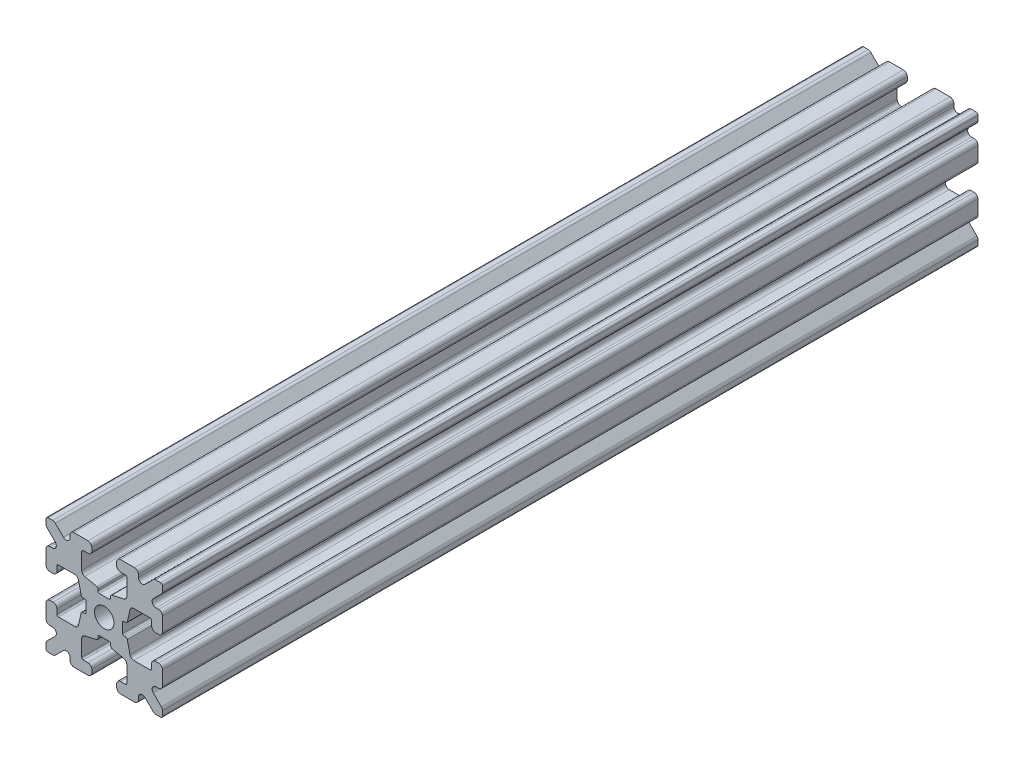
from build123d import *

# Parameters (mm, degrees)
SKETCH1_W           = 15
SKETCH1_H           = 15
SKETCH1_R           = 1.25
BOSS_EXTRUDE1_DEPTH = 52.5
FILLET1_R           = 0.25
CUT_EXTRUDE1_DEPTH  = 106.534354596
CUT_EXTRUDE3_DEPTH  = 106.534354596
FILLET3_R           = 0.5
FILLET4_R           = 0.5
FILLET5_R           = 3
FILLET6_R           = 0.2
CUT_EXTRUDE4_DEPTH  = 106.534354596
FILLET8_R           = 0.5
SKETCH6_W           = 5.1529354
SKETCH6_H           = 1.651
SKETCH6_W_2         = 1.651
SKETCH6_H_2         = 5.1529354
CUT_EXTRUDE5_DEPTH  = 106.534354596
FILLET10_R          = 0.2


with BuildPart() as part:
    # Sketch1 → Boss-Extrude1 (new, symmetric)
    with BuildSketch(Plane.XY):
        Rectangle(SKETCH1_W, SKETCH1_H)
        with Locations(Location((0, 0, 0), (0, 0, 180))):
            Circle(SKETCH1_R, mode=Mode.SUBTRACT)
    extrude(amount=BOSS_EXTRUDE1_DEPTH, both=True)

    # Fillet1
    fillet1_edges = [part.edges().sort_by_distance(p)[0] for p in [
        (7.5, -7.5, 0),
        (-7.5, -7.5, 0),
        (-7.5, 7.5, 0),
        (7.5, 7.5, 0),
    ]]
    fillet(fillet1_edges, radius=FILLET1_R)

    # Sketch2 → Cut-Extrude1 (cut, through all)
    with BuildSketch(Plane.XY.offset(52.5)):
        Polygon((-7.5, 1.6), (-6.1, 1.6), (-6.1, 2.9), (-3.4, 2.9), (-3.4, -2.9), (-6.1, -2.9), (-6.1, -1.6), (-7.5, -1.6), align=None)
        Polygon((2.9, 6.1), (1.6, 6.1), (1.6, 7.5), (-1.6, 7.5), (-1.6, 6.1), (-2.9, 6.1), (-2.9, 3.4), (2.9, 3.4), align=None)
        Polygon((-1.6, -7.5), (-1.6, -6.1), (-2.9, -6.1), (-2.9, -3.4), (2.9, -3.4), (2.9, -6.1), (1.6, -6.1), (1.6, -7.5), align=None)
        Polygon((6.1, -2.9), (6.1, -1.6), (7.5, -1.6), (7.5, 1.6), (6.1, 1.6), (6.1, 2.9), (3.4, 2.9), (3.4, -2.9), align=None)
    extrude(amount=-CUT_EXTRUDE1_DEPTH, mode=Mode.SUBTRACT)

    # Sketch4 → Cut-Extrude3 (cut, through all)
    with BuildSketch(Plane.XY.offset(52.5)):
        Polygon((-3.4, 2.9), (-2.75, 0), (-3.4, -2.9), align=None)
        Polygon((-2.9, 3.4), (0, 2.75), (2.9, 3.4), align=None)
        Polygon((3.4, 2.9), (2.75, 0), (3.4, -2.9), align=None)
        Polygon((-2.9, -3.4), (0, -2.75), (2.9, -3.4), align=None)
    extrude(amount=-CUT_EXTRUDE3_DEPTH, mode=Mode.SUBTRACT)

    # Fillet3
    fillet3_edges = [part.edges().sort_by_distance(p)[0] for p in [
        (1.6, -7.5, 0),
        (-1.6, -7.5, 0),
        (-1.6, -6.1, 0),
        (1.6, -6.1, 0),
        (6.1, 1.6, 0),
        (7.5, 1.6, 0),
        (7.5, -1.6, 0),
        (6.1, -1.6, 0),
        (-7.5, -1.6, 0),
        (-7.5, 1.6, 0),
        (-6.1, 1.6, 0),
        (-6.1, -1.6, 0),
        (-1.6, 6.1, 0),
        (-1.6, 7.5, 0),
        (1.6, 7.5, 0),
        (1.6, 6.1, 0),
    ]]
    fillet(fillet3_edges, radius=FILLET3_R)

    # Fillet4
    fillet4_edges = [part.edges().sort_by_distance(p)[0] for p in [
        (-2.9, -3.4, 0),
        (2.9, -3.4, 0),
        (3.4, -2.9, 0),
        (3.4, 2.9, 0),
        (-3.4, 2.9, 0),
        (-3.4, -2.9, 0),
        (2.9, 3.4, 0),
        (-2.9, 3.4, 0),
    ]]
    fillet(fillet4_edges, radius=FILLET4_R)

    # Fillet5
    fillet5_edges = [part.edges().sort_by_distance(p)[0] for p in [
        (-2.75, 0, 0),
        (0, 2.75, 0),
        (2.75, 0, 0),
        (0, -2.75, 0),
    ]]
    fillet(fillet5_edges, radius=FILLET5_R)

    # Fillet6
    fillet6_edges = [part.edges().sort_by_distance(p)[0] for p in [
        (-2.9, -6.1, 0),
        (2.9, -6.1, 0),
        (6.1, -2.9, 0),
        (6.1, 2.9, 0),
        (-6.1, 2.9, 0),
        (-6.1, -2.9, 0),
        (2.9, 6.1, 0),
        (-2.9, 6.1, 0),
    ]]
    fillet(fillet6_edges, radius=FILLET6_R)

    # Sketch5 → Cut-Extrude4 (cut, through all)
    with BuildSketch(Plane.XY.offset(52.5)):
        Polygon((-7.5, 6.439339828), (-5.460660172, 4.4), (-7.5, 4.4), align=None)
        Polygon((-6.439339828, 7.5), (-4.4, 5.460660172), (-4.4, 7.5), align=None)
        Polygon((4.4, 7.5), (6.439339828, 7.5), (4.4, 5.460660172), align=None)
        Polygon((7.5, 6.439339828), (7.5, 4.4), (5.460660172, 4.4), align=None)
        Polygon((7.5, -6.439339828), (5.460660172, -4.4), (7.5, -4.4), align=None)
        Polygon((6.439339828, -7.5), (4.4, -5.460660172), (4.4, -7.5), align=None)
        Polygon((-4.4, -7.5), (-6.439339828, -7.5), (-4.4, -5.460660172), align=None)
        Polygon((-7.5, -6.439339828), (-7.5, -4.4), (-5.460660172, -4.4), align=None)
    extrude(amount=-CUT_EXTRUDE4_DEPTH, mode=Mode.SUBTRACT)

    # Fillet8
    fillet8_edges = [part.edges().sort_by_distance(p)[0] for p in [
        (-7.5, 4.4, 0),
        (-7.5, 6.439339828, 0),
        (-5.460660172, 4.4, 0),
        (7.5, -4.4, 0),
        (7.5, -6.439339828, 0),
        (5.460660172, -4.4, 0),
        (5.460660172, 4.4, 0),
        (7.5, 6.439339828, 0),
        (7.5, 4.4, 0),
        (-4.4, 7.5, 0),
        (-4.4, 5.460660172, 0),
        (-6.439339828, 7.5, 0),
        (-5.460660172, -4.4, 0),
        (-7.5, -6.439339828, 0),
        (-7.5, -4.4, 0),
        (4.4, 5.460660172, 0),
        (4.4, 7.5, 0),
        (6.439339828, 7.5, 0),
        (6.439339828, -7.5, 0),
        (4.4, -7.5, 0),
        (4.4, -5.460660172, 0),
        (-6.439339828, -7.5, 0),
        (-4.4, -5.460660172, 0),
        (-4.4, -7.5, 0),
    ]]
    fillet(fillet8_edges, radius=FILLET8_R)

    # Sketch6 → Cut-Extrude5 (cut, through all)
    with BuildSketch(Plane.XY.offset(52.5)):
        with Locations((4.9235323, 0)):
            Rectangle(SKETCH6_W, SKETCH6_H)
        with Locations((0, -4.9235323)):
            Rectangle(SKETCH6_W_2, SKETCH6_H_2)
        with Locations((-4.9235323, 0)):
            Rectangle(SKETCH6_W, SKETCH6_H)
        with Locations((0, 4.9235323)):
            Rectangle(SKETCH6_W_2, SKETCH6_H_2)
    extrude(amount=-CUT_EXTRUDE5_DEPTH, mode=Mode.SUBTRACT)

    # Fillet10
    fillet10_edges = [part.edges().sort_by_distance(p)[0] for p in [
        (0.8255, -2.935025862, 0),
        (-0.8255, -2.935025862, 0),
        (0.8255, -2.3470646, 0),
        (-0.8255, -2.3470646, 0),
        (2.935025862, 0.8255, 0),
        (2.935025862, -0.8255, 0),
        (2.3470646, 0.8255, 0),
        (2.3470646, -0.8255, 0),
        (-2.935025862, -0.8255, 0),
        (-2.935025862, 0.8255, 0),
        (-2.3470646, -0.8255, 0),
        (-2.3470646, 0.8255, 0),
        (-0.8255, 2.935025862, 0),
        (0.8255, 2.935025862, 0),
        (-0.8255, 2.3470646, 0),
        (0.8255, 2.3470646, 0),
    ]]
    fillet(fillet10_edges, radius=FILLET10_R)


solid = part.part
